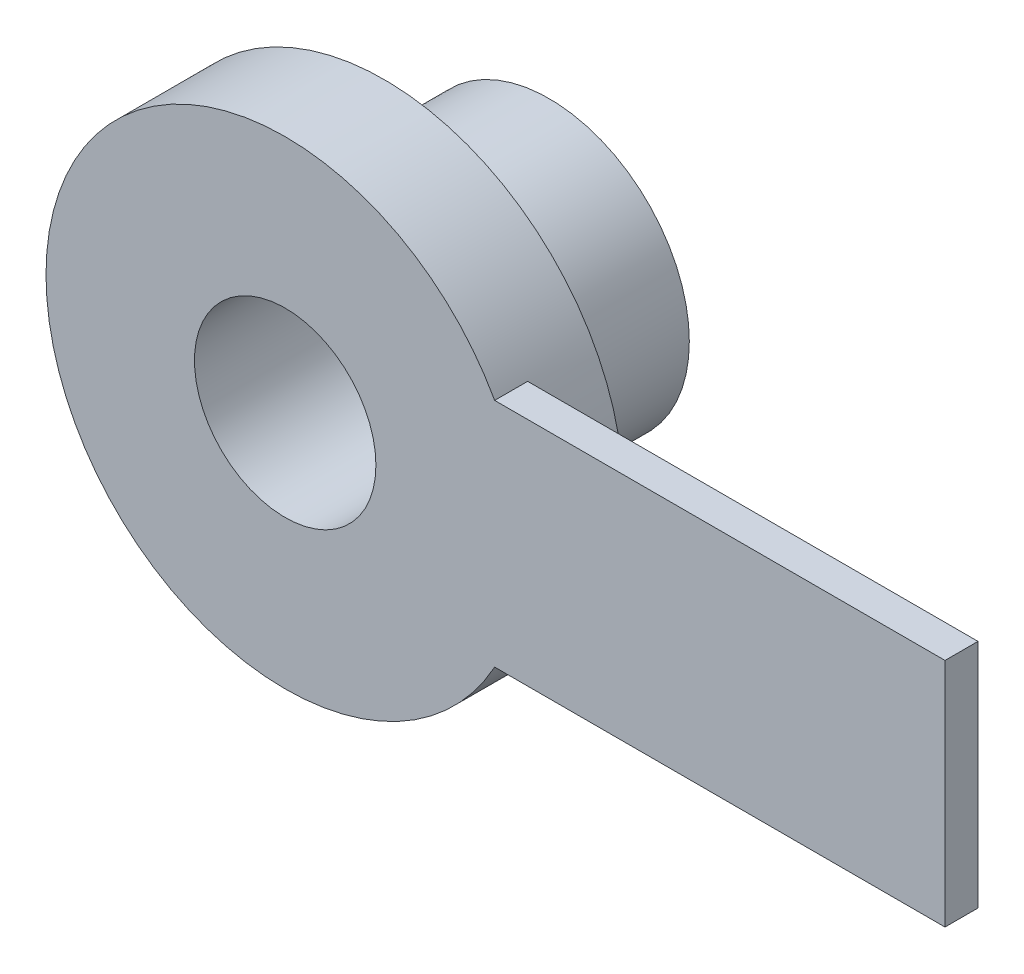
from build123d import *

# Parameters (mm, degrees)
SKETCH_1_W              = 7.25
SKETCH_1_H              = 3
EXTRUDE_1_REACH         = 30.357
EXTRUDE_1_END_RADIUS    = 7.25
SKETCH_2_W              = 1
SKETCH_2_H              = 7
SKETCH_3_R              = 4.25
EXTRUDE_2_DEPTH         = 5
HOLE_WIZARD_5_5_5_5_1_D = 5.5


with BuildPart() as part:
    # Эскиз1 → Повернуть1 (revolve)
    with BuildSketch(Plane.XZ, mode=Mode.PRIVATE) as revolve_1_sk:
        with Locations((3.625, 1.5)):
            Rectangle(SKETCH_1_W, SKETCH_1_H)
    revolve(revolve_1_sk.sketch.rotate(Axis((0, 0, 3), (0, 0, -1)), 180), axis=Axis((0, 0, 3), (0, 0, -1)))

    # Бобышка-Вытянуть1: up to this cylinder (the profile starts outside it)
    extrude_1_end = Plane(origin=(0, 0, 2.5), z_dir=(0, 0, -1)) * Cylinder(EXTRUDE_1_END_RADIUS, 76.214, mode=Mode.PRIVATE)
    # Эскиз2 → Бобышка-Вытянуть1 (add, up to the surface)
    with BuildSketch(Plane(origin=(20, 0, 0), x_dir=(0, 0, -1), z_dir=(1, 0, 0)), mode=Mode.PRIVATE) as extrude_1_sk1:
        with Locations((-2.5, 0)):
            Rectangle(SKETCH_2_W, SKETCH_2_H)
    extrude_1_tool1 = extrude(extrude_1_sk1.sketch, amount=-EXTRUDE_1_REACH, mode=Mode.PRIVATE) - extrude_1_end
    add(extrude_1_tool1.solids().sort_by_distance((20, 0, 2.5))[0])

    # Эскиз3 → Бобышка-Вытянуть2 (add)
    with BuildSketch(Plane(origin=(0, 0, 0), x_dir=(-1, 0, 0), z_dir=(0, 0, -1))):
        Circle(SKETCH_3_R)
    extrude(amount=EXTRUDE_2_DEPTH)

    # Диаметр отверстия Ø5.5 (5.5)1 (through all)
    with Locations(Plane.XY.offset(3)):
        with Locations((0, 0)):
            Hole(HOLE_WIZARD_5_5_5_5_1_D / 2)


solid = part.part
